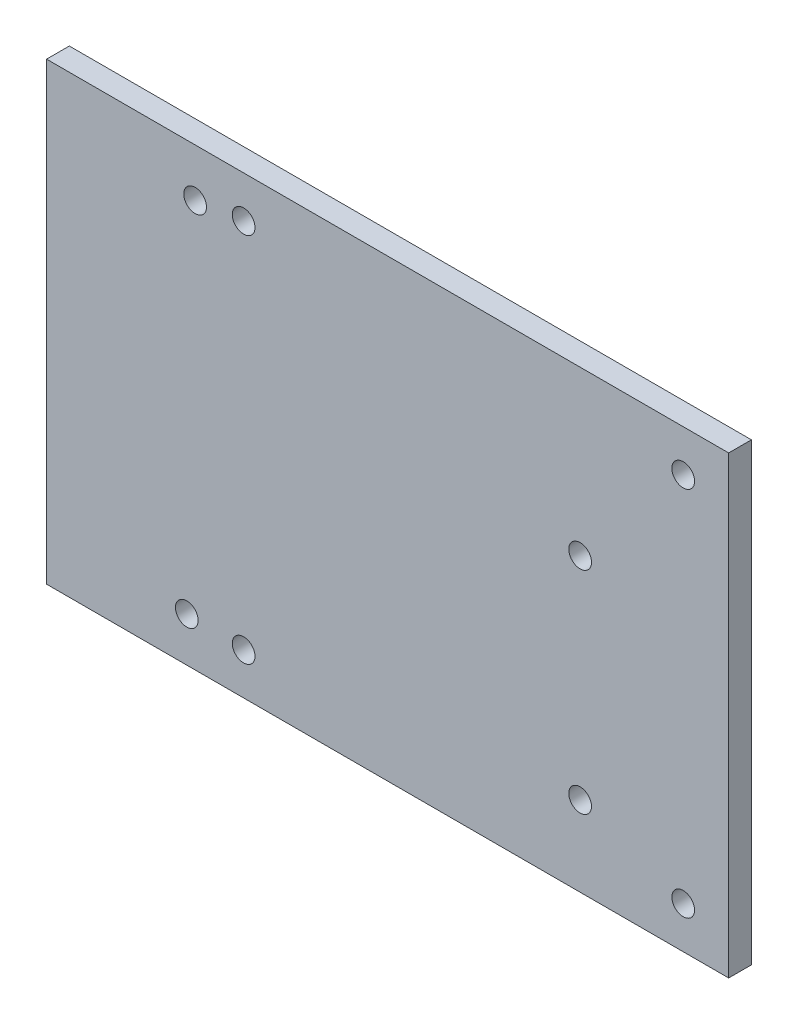
from build123d import *

# Parameters (mm, degrees)
SKETCH1_W           = 90
SKETCH1_H           = 60
SKETCH1_R           = 1.5
BOSS_EXTRUDE1_DEPTH = 3


with BuildPart() as part:
    # Sketch1 → Boss-Extrude1 (new body)
    with BuildSketch(Plane.XY):
        Rectangle(SKETCH1_W, SKETCH1_H)
        with Locations((-25.4, 23.65)):
            Circle(SKETCH1_R, mode=Mode.SUBTRACT)
        with Locations((-26.5, -24.15)):
            Circle(SKETCH1_R, mode=Mode.SUBTRACT)
        with Locations((25.4, -19.45)):
            Circle(SKETCH1_R, mode=Mode.SUBTRACT)
        with Locations((25.4, 8.45)):
            Circle(SKETCH1_R, mode=Mode.SUBTRACT)
        with Locations((-19, -24.5)):
            Circle(SKETCH1_R, mode=Mode.SUBTRACT)
        with Locations((-19, 24.5)):
            Circle(SKETCH1_R, mode=Mode.SUBTRACT)
        with Locations((39, 24.5)):
            Circle(SKETCH1_R, mode=Mode.SUBTRACT)
        with Locations((39, -24.5)):
            Circle(SKETCH1_R, mode=Mode.SUBTRACT)
    extrude(amount=BOSS_EXTRUDE1_DEPTH)


solid = part.part
